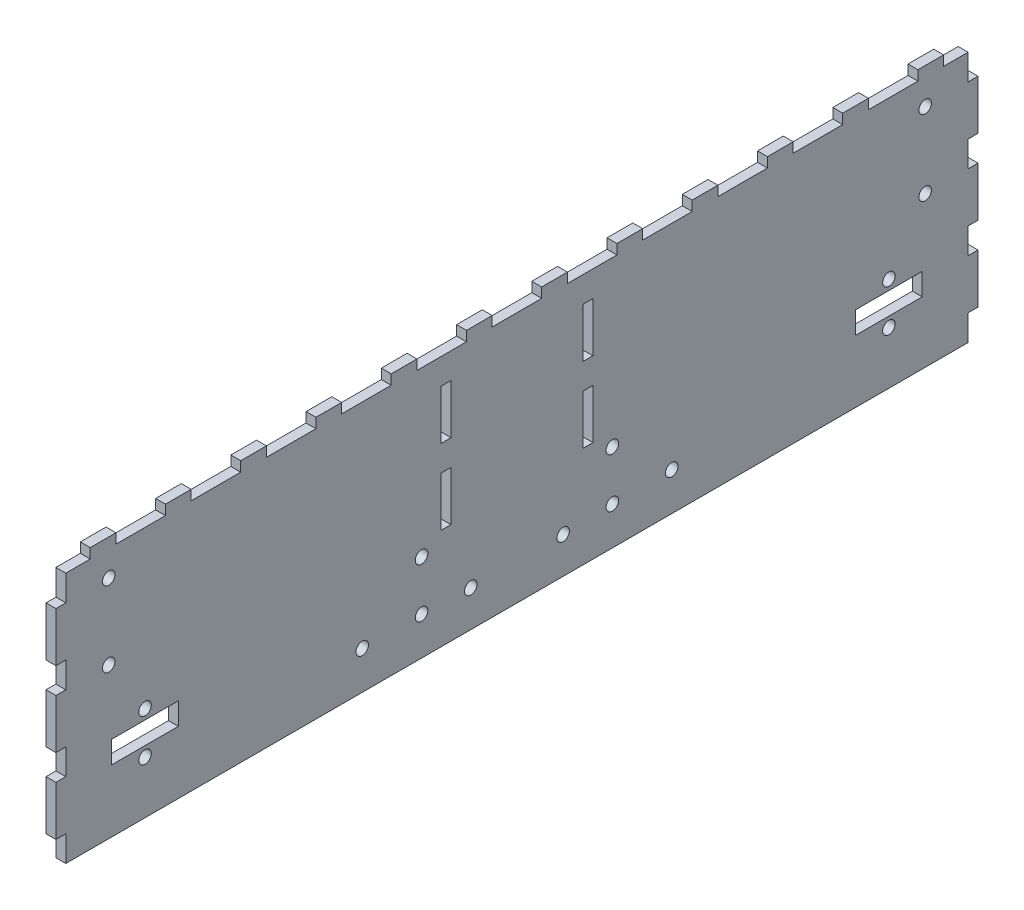
from build123d import *

# Parameters (mm, degrees)
SKETCH1_W               = 279.4
SKETCH1_H               = 76.2
BOSS_EXTRUDE1_DEPTH     = 3
SKETCH3_W               = 3
SKETCH3_H               = 7.8
CUT_EXTRUDE1_DEPTH      = 145.833352512
LPATTERN1_COUNT         = 4
LPATTERN1_PITCH         = 22.8
MIRROR1_COPY_1_SKETCH_W = 3
MIRROR1_COPY_1_SKETCH_H = 7.8
MIRROR1_COPY_1_DEPTH    = 145.833352512
MIRROR1_COPY_2_SKETCH_W = 3
MIRROR1_COPY_2_SKETCH_H = 7.8
MIRROR1_COPY_2_DEPTH    = 145.833352512
MIRROR1_COPY_3_SKETCH_W = 3
MIRROR1_COPY_3_SKETCH_H = 7.8
MIRROR1_COPY_3_DEPTH    = 145.833352512
SKETCH5_W               = 3
SKETCH5_H               = 15
CUT_EXTRUDE3_DEPTH      = 10
SKETCH9_W               = 3
SKETCH9_H               = 7.8
BOSS_EXTRUDE2_DEPTH     = 3
LPATTERN4_COUNT         = 12
LPATTERN4_PITCH         = 22.8
LPATTERN5_COUNT         = 2
LPATTERN5_PITCH         = 22.8
MIRROR2_COPY_1_SKETCH_W = 3
MIRROR2_COPY_1_SKETCH_H = 15
MIRROR2_COPY_1_DEPTH    = 10
F_6_CLEARANCE_HOLE1_D   = 3.7973
CUT_EXTRUDE4_REACH      = 147.651
SKETCH12_W              = 20.2
SKETCH12_H              = 6.7
F_6_CLEARANCE_HOLE2_D   = 3.7973
F_6_CLEARANCE_HOLE3_D   = 3.7973
F_6_CLEARANCE_HOLE4_D   = 3.7973


with BuildPart() as part:
    # Sketch1 → Boss-Extrude1 (new body)
    with BuildSketch(Plane(origin=(0, 0, 0), x_dir=(0, 0, -1), z_dir=(1, 0, 0))):
        Rectangle(SKETCH1_W, SKETCH1_H)
    extrude(amount=-BOSS_EXTRUDE1_DEPTH)

    # Sketch3 → Cut-Extrude1 (cut, through all)
    with BuildSketch(Plane.ZY.offset(3)):
        with Locations((-138.2, 34.2)):
            Rectangle(SKETCH3_W, SKETCH3_H)
    cut_extrude1 = extrude(amount=-CUT_EXTRUDE1_DEPTH, mode=Mode.SUBTRACT)

    # LPattern1: Cut-Extrude1 ×4
    with Locations(*[(0, -i * LPATTERN1_PITCH, 0) for i in range(1, LPATTERN1_COUNT)]):
        add(cut_extrude1, mode=Mode.SUBTRACT)

    # Mirror1: Cut-Extrude1 across plane
    add(cut_extrude1.mirror(Plane.XY), mode=Mode.SUBTRACT)

    # Mirror1 copy 1 sketch → Mirror1 copy 1 (cut, through all)
    with BuildSketch(Plane(origin=(-3, -22.8, 0), x_dir=(0, 0, -1), z_dir=(-1, 0, 0))):
        with Locations((-138.2, -34.2)):
            Rectangle(MIRROR1_COPY_1_SKETCH_W, MIRROR1_COPY_1_SKETCH_H)
    extrude(amount=-MIRROR1_COPY_1_DEPTH, mode=Mode.SUBTRACT)

    # Mirror1 copy 2 sketch → Mirror1 copy 2 (cut, through all)
    with BuildSketch(Plane(origin=(-3, -45.6, 0), x_dir=(0, 0, -1), z_dir=(-1, 0, 0))):
        with Locations((-138.2, -34.2)):
            Rectangle(MIRROR1_COPY_2_SKETCH_W, MIRROR1_COPY_2_SKETCH_H)
    extrude(amount=-MIRROR1_COPY_2_DEPTH, mode=Mode.SUBTRACT)

    # Mirror1 copy 3 sketch → Mirror1 copy 3 (cut, through all)
    with BuildSketch(Plane(origin=(-3, -68.4, 0), x_dir=(0, 0, -1), z_dir=(-1, 0, 0))):
        with Locations((-138.2, -34.2)):
            Rectangle(MIRROR1_COPY_3_SKETCH_W, MIRROR1_COPY_3_SKETCH_H)
    extrude(amount=-MIRROR1_COPY_3_DEPTH, mode=Mode.SUBTRACT)

    # Sketch5 → Cut-Extrude3 (cut)
    with BuildSketch(Plane.ZY.offset(3)):
        with Locations((-21.5, 22.8)):
            Rectangle(SKETCH5_W, SKETCH5_H)
    cut_extrude3 = extrude(amount=-CUT_EXTRUDE3_DEPTH, mode=Mode.SUBTRACT)

    # Sketch9 → Boss-Extrude2 (add)
    with BuildSketch(Plane(origin=(0, 38.1, 0), x_dir=(1, 0, 0), z_dir=(0, 1, 0))):
        with Locations((-1.5, 125.4)):
            Rectangle(SKETCH9_W, SKETCH9_H)
    boss_extrude2 = extrude(amount=BOSS_EXTRUDE2_DEPTH)

    # LPattern4: Boss-Extrude2 ×12
    with Locations(*[(0, 0, i * LPATTERN4_PITCH) for i in range(1, LPATTERN4_COUNT)]):
        add(boss_extrude2)

    # LPattern5: Cut-Extrude3 ×2
    with Locations(*[(0, -i * LPATTERN5_PITCH, 0) for i in range(1, LPATTERN5_COUNT)]):
        add(cut_extrude3, mode=Mode.SUBTRACT)

    # Mirror2: Cut-Extrude3 across plane
    add(cut_extrude3.mirror(Plane.XY), mode=Mode.SUBTRACT)

    # Mirror2 copy 1 sketch → Mirror2 copy 1 (cut)
    with BuildSketch(Plane(origin=(-3, -22.8, 0), x_dir=(0, 0, -1), z_dir=(-1, 0, 0))):
        with Locations((-21.5, -22.8)):
            Rectangle(MIRROR2_COPY_1_SKETCH_W, MIRROR2_COPY_1_SKETCH_H)
    extrude(amount=-MIRROR2_COPY_1_DEPTH, mode=Mode.SUBTRACT)

    # #6 Clearance Hole1 (through all)
    with Locations(Plane(origin=(0, 0, 0), x_dir=(0, 0, -1), z_dir=(1, 0, 0))):
        with Locations((-28.9, -11.55), (-28.9, -26.55), (28.9, -26.55), (28.9, -11.55), (-46.9, -26.55), (46.9, -26.55)):
            Hole(F_6_CLEARANCE_HOLE1_D / 2)

    # Sketch12 → Cut-Extrude4 (cut, up to next)
    with BuildSketch(Plane(origin=(0, 0, 0), x_dir=(0, 0, -1), z_dir=(1, 0, 0)), mode=Mode.PRIVATE) as cut_extrude4_sk1:
        with Locations((-112.7, -15.8)):
            Rectangle(SKETCH12_W, SKETCH12_H)
    cut_extrude4_tool1 = extrude(cut_extrude4_sk1.sketch, amount=-CUT_EXTRUDE4_REACH, mode=Mode.PRIVATE) & part.part
    # Sketch12 → Cut-Extrude4 (cut, up to next)
    with BuildSketch(Plane(origin=(0, 0, 0), x_dir=(0, 0, -1), z_dir=(1, 0, 0)), mode=Mode.PRIVATE) as cut_extrude4_sk2:
        with Locations((112.7, -15.8)):
            Rectangle(SKETCH12_W, SKETCH12_H)
    cut_extrude4_tool2 = extrude(cut_extrude4_sk2.sketch, amount=-CUT_EXTRUDE4_REACH, mode=Mode.PRIVATE) & part.part
    add(cut_extrude4_tool1.solids().sort_by_distance((0, -15.8, 112.7))[0], mode=Mode.SUBTRACT)
    add(cut_extrude4_tool2.solids().sort_by_distance((0, -15.8, -112.7))[0], mode=Mode.SUBTRACT)

    # #6 Clearance Hole2 (through all)
    with Locations(Plane.ZY.offset(3)):
        with Locations((-112.7, -9.45), (-112.7, -22.15), (112.7, -22.15), (112.7, -9.45)):
            Hole(F_6_CLEARANCE_HOLE2_D / 2)

    # #6 Clearance Hole3 (through all)
    with Locations(Plane.ZY.offset(3)):
        with Locations((14, -27.1), (-14, -27.1)):
            Hole(F_6_CLEARANCE_HOLE3_D / 2)

    # #6 Clearance Hole4 (through all)
    with Locations(Plane.ZY.offset(3)):
        with Locations((-123.7, 30.3), (-123.7, 7.5), (123.7, 7.5), (123.7, 30.3)):
            Hole(F_6_CLEARANCE_HOLE4_D / 2)


solid = part.part
